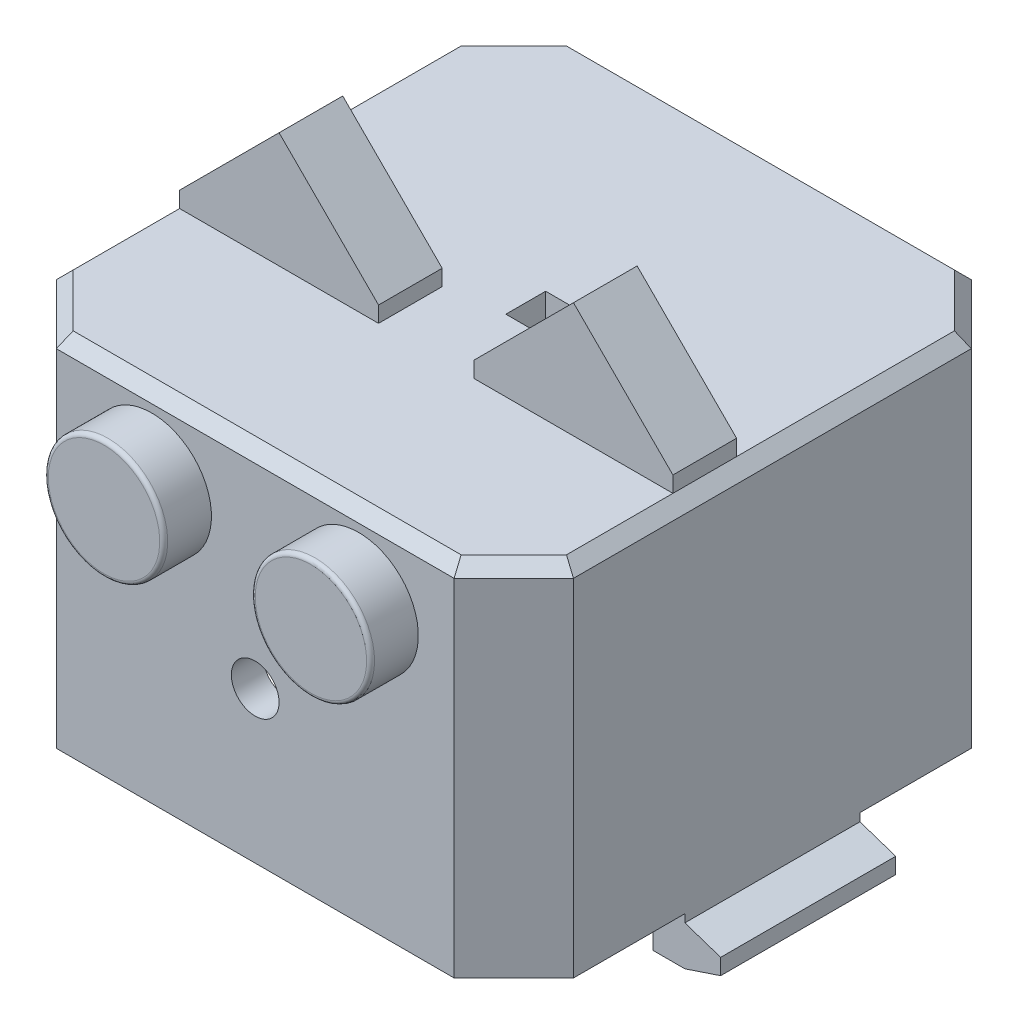
from build123d import *

# Parameters (mm, degrees)
SALIENTE_EXTRUIR1_DEPTH  = 45
VACIADO2_T               = -4
CHAFL_N3_SIZE            = 1.5
CROQUIS2_R               = 7.5
SALIENTE_EXTRUIR2_DEPTH  = 6
CROQUIS4_R               = 5
CORTAR_EXTRUIR2_DEPTH    = 8
REDONDEO1_R              = 0.5
CROQUIS5_R               = 3
CORTAR_EXTRUIR3_DEPTH    = 10
SALIENTE_EXTRUIR8_START  = 8
CROQUIS13_R              = 5
CROQUIS13_R_2            = 2.6
SALIENTE_EXTRUIR8_DEPTH  = 8
CROQUIS7_W               = 4
CROQUIS7_H               = 4
SALIENTE_EXTRUIR3_DEPTH  = 1
CROQUIS8_R               = 2
SALIENTE_EXTRUIR4_DEPTH  = 1
CROQUIS9_R               = 1.6
CORTAR_EXTRUIR5_DEPTH    = 2
CROQUIS10_W              = 25
CROQUIS10_H              = 8
SALIENTE_EXTRUIR5_DEPTH  = 2
SALIENTE_EXTRUIR6_DEPTH  = 8
CROQUIS12_R              = 1.15
CROQUIS12_R_2            = 0.8
SALIENTE_EXTRUIR7_DEPTH  = 6
CROQUIS14_W              = 3
CROQUIS14_H              = 2.5
SALIENTE_EXTRUIR9_DEPTH  = 5
CROQUIS15_W              = 12
CROQUIS15_H              = 8
CORTAR_EXTRUIR6_DEPTH    = 7
CROQUIS16_W              = 14.5
CROQUIS16_H              = 14.5
CROQUIS16_W_2            = 12.4
CROQUIS16_H_2            = 12.4
SALIENTE_EXTRUIR10_DEPTH = 3
CROQUIS17_R              = 5.5
CORTAR_EXTRUIR7_DEPTH    = 96.317889192
CROQUIS18_W              = 4
CROQUIS18_H              = 22
SALIENTE_EXTRUIR11_DEPTH = 6
SALIENTE_EXTRUIR13_DEPTH = 22
CROQUIS20_W              = 5
CROQUIS20_H              = 5
CORTAR_EXTRUIR8_DEPTH    = 10


with BuildPart() as part:
    # Croquis1 → Saliente-Extruir1 (new body)
    with BuildSketch(Plane(origin=(0, 0, 0), x_dir=(1, 0, 0), z_dir=(0, 1, 0))):
        Polygon((-25, -32.5), (25, -32.5), (32.5, -25), (32.5, 25), (25, 32.5), (-25, 32.5), (-32.5, 25), (-32.5, -25), align=None)
    extrude(amount=SALIENTE_EXTRUIR1_DEPTH)

    # Vaciado2
    vaciado2_openings = [part.faces().sort_by_distance(p)[0] for p in [
        (0, 0, 0),
    ]]
    offset(amount=VACIADO2_T, openings=vaciado2_openings, kind=Kind.INTERSECTION)

    # Chaflán3
    chafl_n3_edges = [part.edges().sort_by_distance(p)[0] for p in [
        (-28.75, 45, -28.75),
        (-32.5, 45, 0),
        (-28.75, 45, 28.75),
        (0, 45, 32.5),
        (28.75, 45, 28.75),
        (32.5, 45, 0),
        (28.75, 45, -28.75),
        (0, 45, -32.5),
    ]]
    chamfer(chafl_n3_edges, length=CHAFL_N3_SIZE)

    # Croquis2 → Saliente-Extruir2 (add)
    with BuildSketch(Plane.XY.offset(32.5)):
        with Locations(Location((13, 35, 0), (0, 0, 180))):
            Circle(CROQUIS2_R)
        with Locations(Location((-13, 35, 0), (0, 0, 180))):
            Circle(CROQUIS2_R)
    extrude(amount=SALIENTE_EXTRUIR2_DEPTH)

    # Croquis4 → Cortar-Extruir2 (cut)
    with BuildSketch(Plane(origin=(0, 0, 28.5), x_dir=(-1, 0, 0), z_dir=(0, 0, -1))):
        with Locations((-13, 35)):
            Circle(CROQUIS4_R)
        with Locations(Location((13, 35, 0), (0, 0, 180))):
            Circle(CROQUIS4_R)
    extrude(amount=-CORTAR_EXTRUIR2_DEPTH, mode=Mode.SUBTRACT)

    # Redondeo1
    redondeo1_edges = [part.edges().sort_by_distance(p)[0] for p in [
        (20.5, 35, 38.5),
        (-5.5, 35, 38.5),
    ]]
    fillet(redondeo1_edges, radius=REDONDEO1_R)

    # Croquis5 → Cortar-Extruir3 (cut)
    with BuildSketch(Plane.XY.offset(32.5)):
        with Locations((0, 19)):
            Circle(CROQUIS5_R)
    extrude(amount=-CORTAR_EXTRUIR3_DEPTH, mode=Mode.SUBTRACT)

    # Croquis13 → Saliente-Extruir8 (add)
    # profile 1 of 2: a face of its own
    with BuildSketch(Plane(origin=(0, 0, 36.5), x_dir=(-1, 0, 0), z_dir=(0, 0, -1)).offset(SALIENTE_EXTRUIR8_START)):
        with Locations((13, 35)):
            Circle(CROQUIS13_R)
        with Locations((13, 35)):
            Circle(CROQUIS13_R_2, mode=Mode.SUBTRACT)
    # profile 2 of 2: a face of its own
    with BuildSketch(Plane(origin=(0, 0, 36.5), x_dir=(-1, 0, 0), z_dir=(0, 0, -1)).offset(SALIENTE_EXTRUIR8_START)):
        with Locations((-13, 35)):
            Circle(CROQUIS13_R)
        with Locations((-13, 35)):
            Circle(CROQUIS13_R_2, mode=Mode.SUBTRACT)
    extrude(amount=-SALIENTE_EXTRUIR8_DEPTH)

    # Croquis7 → Saliente-Extruir3 (add)
    with BuildSketch(Plane(origin=(0, 0, 28.5), x_dir=(-1, 0, 0), z_dir=(0, 0, -1))):
        with Locations((-11.58, 10.5)):
            Rectangle(CROQUIS7_W, CROQUIS7_H)
        with Locations((-11.58, 28)):
            Rectangle(CROQUIS7_W, CROQUIS7_H)
        with Locations((11.43, 10.5)):
            Rectangle(CROQUIS7_W, CROQUIS7_H)
        with Locations((11.43, 28)):
            Rectangle(CROQUIS7_W, CROQUIS7_H)
    extrude(amount=SALIENTE_EXTRUIR3_DEPTH)

    # Croquis8 → Saliente-Extruir4 (add)
    with BuildSketch(Plane(origin=(0, 0, 27.5), x_dir=(-1, 0, 0), z_dir=(0, 0, -1))):
        with Locations(Location((-11.505, 10.489346828, 0), (0, 0, 264.083633631))):
            Circle(CROQUIS8_R)
        with Locations(Location((-11.505, 27.976317365, 0), (0, 0, 261.173934846))):
            Circle(CROQUIS8_R)
        with Locations(Location((11.505, 10.489346828, 0), (0, 0, 180))):
            Circle(CROQUIS8_R)
        with Locations(Location((11.505, 27.976317365, 0), (0, 0, 180))):
            Circle(CROQUIS8_R)
    extrude(amount=SALIENTE_EXTRUIR4_DEPTH)

    # Croquis9 → Cortar-Extruir5 (cut)
    with BuildSketch(Plane(origin=(0, 0, 26.5), x_dir=(-1, 0, 0), z_dir=(0, 0, -1))):
        with Locations((-11.505, 27.976317365)):
            Circle(CROQUIS9_R)
        with Locations((-11.505, 10.489346828)):
            Circle(CROQUIS9_R)
        with Locations((11.505, 10.489346828)):
            Circle(CROQUIS9_R)
        with Locations((11.505, 27.976317365)):
            Circle(CROQUIS9_R)
    extrude(amount=-CORTAR_EXTRUIR5_DEPTH, mode=Mode.SUBTRACT)

    # Croquis10 → Saliente-Extruir5 (add)
    with BuildSketch(Plane(origin=(0, 45, 0), x_dir=(1, 0, 0), z_dir=(0, 1, 0))):
        with Locations((-18.5, -7)):
            Rectangle(CROQUIS10_W, CROQUIS10_H)
        with Locations((18.5, -7)):
            Rectangle(CROQUIS10_W, CROQUIS10_H)
    extrude(amount=SALIENTE_EXTRUIR5_DEPTH)

    # Croquis11 → Saliente-Extruir6 (add)
    with BuildSketch(Plane.XY.offset(11)):
        Polygon((-31, 47), (-6, 47), (-18.5, 59.5), align=None)
        Polygon((31, 47), (18.5, 59.5), (6, 47), align=None)
    extrude(amount=-SALIENTE_EXTRUIR6_DEPTH)

    # Croquis12 → Saliente-Extruir7 (add)
    # profile 1 of 4: a face of its own
    with BuildSketch(Plane.XZ.offset(-41)):
        with Locations(Location((-20.65, 7.68, 0), (0, 0, 270))):
            Circle(CROQUIS12_R)
        with Locations(Location((-20.65, 7.68, 0), (0, 0, 270))):
            Circle(CROQUIS12_R_2, mode=Mode.SUBTRACT)
    # profile 2 of 4: a face of its own
    with BuildSketch(Plane.XZ.offset(-41)):
        with Locations(Location((-20.65, -7.68, 0), (0, 0, 90))):
            Circle(CROQUIS12_R)
        with Locations(Location((-20.65, -7.68, 0), (0, 0, 90))):
            Circle(CROQUIS12_R_2, mode=Mode.SUBTRACT)
    # profile 3 of 4: a face of its own
    with BuildSketch(Plane.XZ.offset(-41)):
        with Locations(Location((20.65, 7.68, 0), (0, 0, 90))):
            Circle(CROQUIS12_R)
        with Locations(Location((20.65, 7.68, 0), (0, 0, 90))):
            Circle(CROQUIS12_R_2, mode=Mode.SUBTRACT)
    # profile 4 of 4: a face of its own
    with BuildSketch(Plane.XZ.offset(-41)):
        with Locations(Location((20.65, -7.68, 0), (0, 0, 270))):
            Circle(CROQUIS12_R)
        with Locations(Location((20.65, -7.68, 0), (0, 0, 270))):
            Circle(CROQUIS12_R_2, mode=Mode.SUBTRACT)
    extrude(amount=SALIENTE_EXTRUIR7_DEPTH)

    # Croquis14 → Saliente-Extruir9 (add)
    with BuildSketch(Plane.XZ.offset(-41)):
        with Locations((-20.65, 7.68)):
            Rectangle(CROQUIS14_W, CROQUIS14_H)
        with Locations((-20.65, -7.68)):
            Rectangle(CROQUIS14_W, CROQUIS14_H)
        with Locations((20.65, 7.68)):
            Rectangle(CROQUIS14_W, CROQUIS14_H)
        with Locations((20.65, -7.68)):
            Rectangle(CROQUIS14_W, CROQUIS14_H)
    extrude(amount=SALIENTE_EXTRUIR9_DEPTH)

    # Croquis15 → Cortar-Extruir6 (cut)
    with BuildSketch(Plane.ZY.offset(32.5)):
        with Locations((0, 36.5)):
            Rectangle(CROQUIS15_W, CROQUIS15_H)
    extrude(amount=-CORTAR_EXTRUIR6_DEPTH, mode=Mode.SUBTRACT)

    # Croquis16 → Saliente-Extruir10 (add)
    with BuildSketch(Plane.XY.offset(-28.5)):
        with Locations((12.75, 12.25)):
            Rectangle(CROQUIS16_W, CROQUIS16_H)
        with Locations((12.75, 12.25)):
            Rectangle(CROQUIS16_W_2, CROQUIS16_H_2, mode=Mode.SUBTRACT)
    extrude(amount=SALIENTE_EXTRUIR10_DEPTH)

    # Croquis17 → Cortar-Extruir7 (cut, through all)
    with BuildSketch(Plane.XY.offset(-28.5)):
        with Locations((12.75, 12.25)):
            Circle(CROQUIS17_R)
    extrude(amount=-CORTAR_EXTRUIR7_DEPTH, mode=Mode.SUBTRACT)

    # Croquis18 → Saliente-Extruir11 (add)
    with BuildSketch(Plane.XZ):
        with Locations((-30.5, 0)):
            Rectangle(CROQUIS18_W, CROQUIS18_H)
        with Locations((30.5, 0)):
            Rectangle(CROQUIS18_W, CROQUIS18_H)
    extrude(amount=SALIENTE_EXTRUIR11_DEPTH)

    # Croquis19 → Saliente-Extruir13 (add)
    with BuildSketch(Plane.XY.offset(11)):
        Polygon((-32.5, -1), (-37, -2.5), (-37, -4.5), (-32.5, -6), align=None)
        Polygon((37, -2.5), (37, -4.5), (32.5, -6), (32.5, -1), align=None)
    extrude(amount=-SALIENTE_EXTRUIR13_DEPTH)

    # Croquis20 → Cortar-Extruir8 (cut)
    with BuildSketch(Plane(origin=(0, 45, 0), x_dir=(1, 0, 0), z_dir=(0, 1, 0))):
        with Locations((3.50287975, 0.5)):
            Rectangle(CROQUIS20_W, CROQUIS20_H)
    extrude(amount=-CORTAR_EXTRUIR8_DEPTH, mode=Mode.SUBTRACT)


solid = part.part
